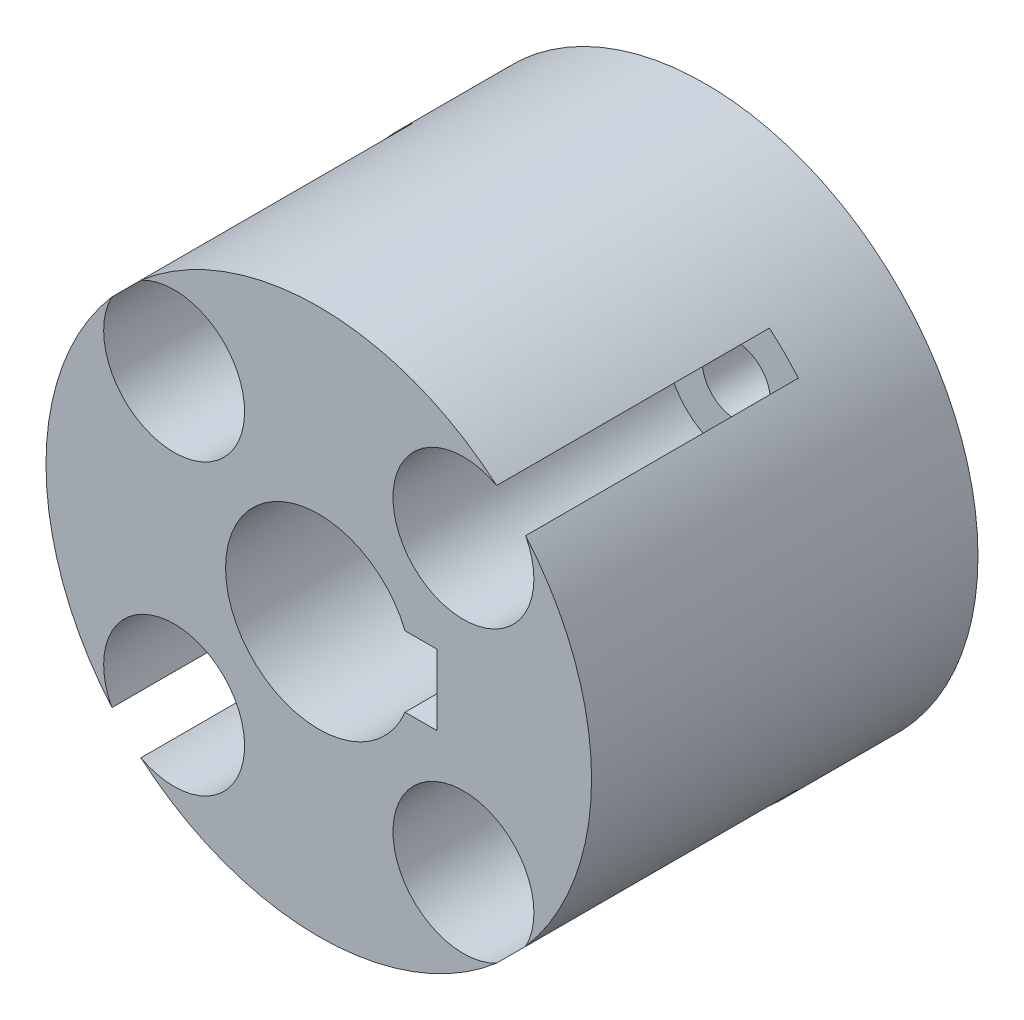
from build123d import *

# Parameters (mm, degrees)
SKIZZE1_R                       = 12
SKIZZE1_R_2                     = 1.5
AUFSATZ_LINEAR_AUSTRAGEN1_DEPTH = 17
SKIZZE2_R                       = 3.1
SCHNITT_LINEAR_AUSTRAGEN2_DEPTH = 12


with BuildPart() as part:
    # Skizze1 → Aufsatz-Linear austragen1 (new body)
    with BuildSketch(Plane.XY):
        Circle(SKIZZE1_R)
        with Locations((6.363961031, 6.363961031)):
            Circle(SKIZZE1_R_2, mode=Mode.SUBTRACT)
        with Locations((-6.363961031, 6.363961031)):
            Circle(SKIZZE1_R_2, mode=Mode.SUBTRACT)
        with Locations((-6.363961031, -6.363961031)):
            Circle(SKIZZE1_R_2, mode=Mode.SUBTRACT)
        with Locations((6.363961031, -6.363961031)):
            Circle(SKIZZE1_R_2, mode=Mode.SUBTRACT)
        with BuildLine():
            ThreePointArc((3.795721275, -1.55), (-4.1, 0), (3.795721275, 1.55))
            Line((3.795721275, 1.55), (5.2, 1.55))
            Line((5.2, 1.55), (5.2, -1.55))
            Line((5.2, -1.55), (3.795721275, -1.55))
        make_face(mode=Mode.SUBTRACT)
    extrude(amount=AUFSATZ_LINEAR_AUSTRAGEN1_DEPTH)

    # Skizze2 → Schnitt-Linear austragen2 (cut)
    with BuildSketch(Plane.XY.offset(17)):
        with Locations((-6.363961031, 6.363961031)):
            Circle(SKIZZE2_R)
        with Locations((6.363961031, 6.363961031)):
            Circle(SKIZZE2_R)
        with Locations((6.363961031, -6.363961031)):
            Circle(SKIZZE2_R)
        with Locations((-6.363961031, -6.363961031)):
            Circle(SKIZZE2_R)
    extrude(amount=-SCHNITT_LINEAR_AUSTRAGEN2_DEPTH, mode=Mode.SUBTRACT)


solid = part.part
